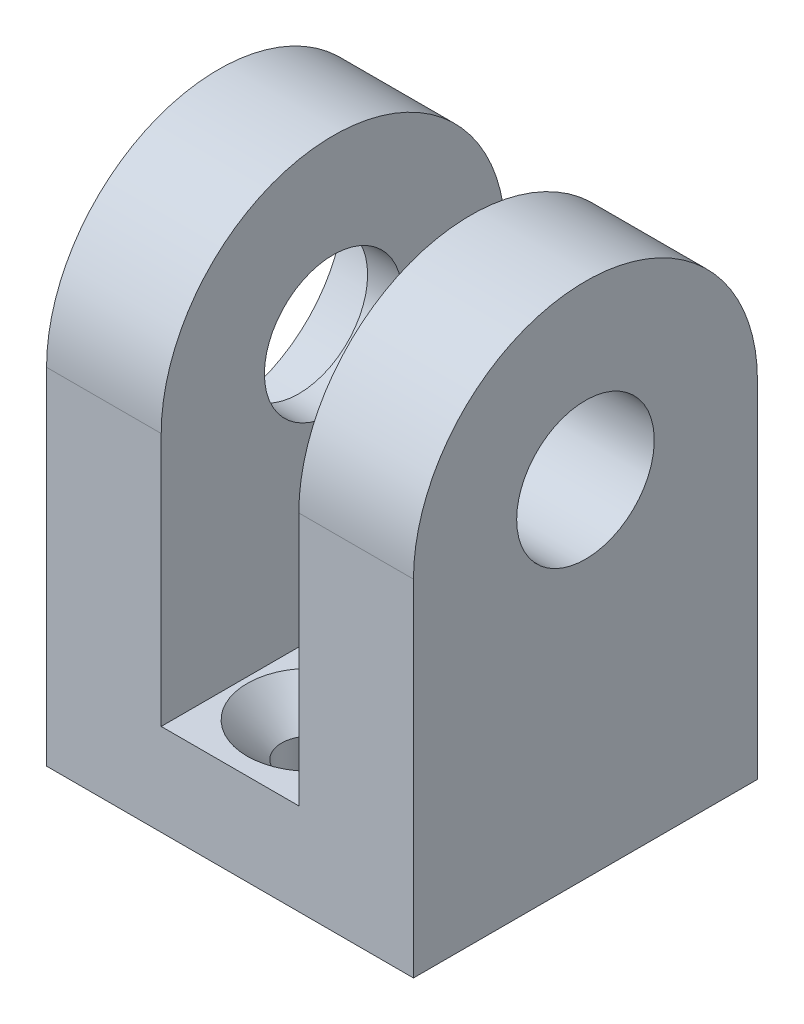
from build123d import *

# Parameters (mm, degrees)
SKETCH_1_W          = 32
SKETCH_1_H          = 30
EXTRUDE_1_DEPTH     = 8
SKETCH_2_R          = 6
EXTRUDE_2_DEPTH     = 10
CUT_EXTRUDE_START   = 10
SKETCH_4_R          = 11
CUT_EXTRUDE_1_DEPTH = 7
SKETCH_5_R          = 2.5
CUT_EXTRUDE_2_DEPTH = 44.119202509
CHAMFER_1_SIZE      = 3


with BuildPart() as part:
    # 草图1 → 凸台-拉伸1 (new body)
    with BuildSketch(Plane(origin=(0, 0, 0), x_dir=(1, 0, 0), z_dir=(0, 1, 0))):
        Rectangle(SKETCH_1_W, SKETCH_1_H)
    extrude(amount=EXTRUDE_1_DEPTH)

    # 草图2 → 凸台-拉伸2 (add)
    with BuildSketch(Plane.ZY.offset(16)):
        with BuildLine():
            Line((15, 0), (-15, 0))
            Line((-15, 0), (-15, 30.125))
            ThreePointArc((-15, 30.125), (0, 45.125), (15, 30.125))
            Line((15, 30.125), (15, 0))
        make_face()
        with Locations((0, 30.125)):
            Circle(SKETCH_2_R, mode=Mode.SUBTRACT)
    extrude_2 = extrude(amount=-EXTRUDE_2_DEPTH)

    # 草图4 → 切除-拉伸1 (cut)
    with BuildSketch(Plane.ZY.offset(6).offset(CUT_EXTRUDE_START)):
        with Locations(Location((0, 30.125, 0), (0, 0, 180))):
            Circle(SKETCH_4_R)
    extrude(amount=-CUT_EXTRUDE_1_DEPTH, mode=Mode.SUBTRACT)

    # 镜向1: 凸台-拉伸2 across plane
    add(extrude_2.mirror(Plane(origin=(0, 0, 0), x_dir=(0, 0, 1), z_dir=(1, 0, 0))))

    # 草图5 → 切除-拉伸2 (cut, through all)
    with BuildSketch(Plane(origin=(0, 8, 0), x_dir=(1, 0, 0), z_dir=(0, 1, 0))):
        with Locations(Location((0, 8, 0), (0, 0, 270))):
            Circle(SKETCH_5_R)
        with Locations(Location((0, -8, 0), (0, 0, 270))):
            Circle(SKETCH_5_R)
    extrude(amount=-CUT_EXTRUDE_2_DEPTH, mode=Mode.SUBTRACT)

    # 倒角1
    chamfer_1_edges = [part.edges().sort_by_distance(p)[0] for p in [
        (0, 8, -10.5),
        (0, 8, 5.5),
    ]]
    chamfer(chamfer_1_edges, length=CHAMFER_1_SIZE)


solid = part.part
